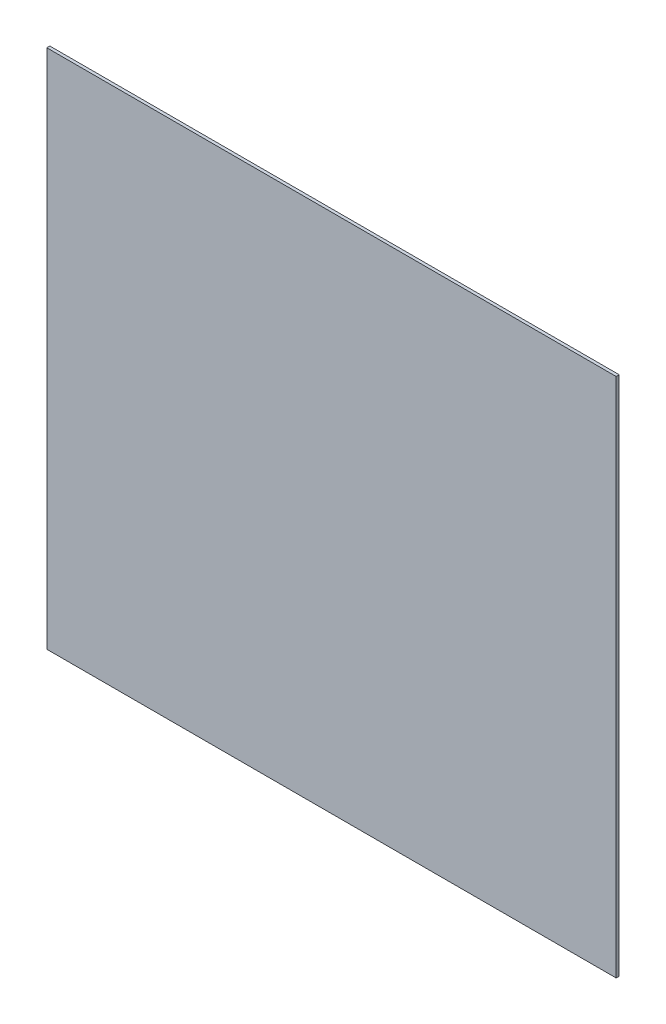
from build123d import *

# Parameters (mm, degrees)
SKETCH2_W           = 596.9
SKETCH2_H           = 546.1
BOSS_EXTRUDE1_DEPTH = 3.175


with BuildPart() as part:
    # Sketch2 → Boss-Extrude1 (new body)
    with BuildSketch(Plane.XY):
        with Locations((0, 273.05)):
            Rectangle(SKETCH2_W, SKETCH2_H)
    extrude(amount=BOSS_EXTRUDE1_DEPTH)


solid = part.part
